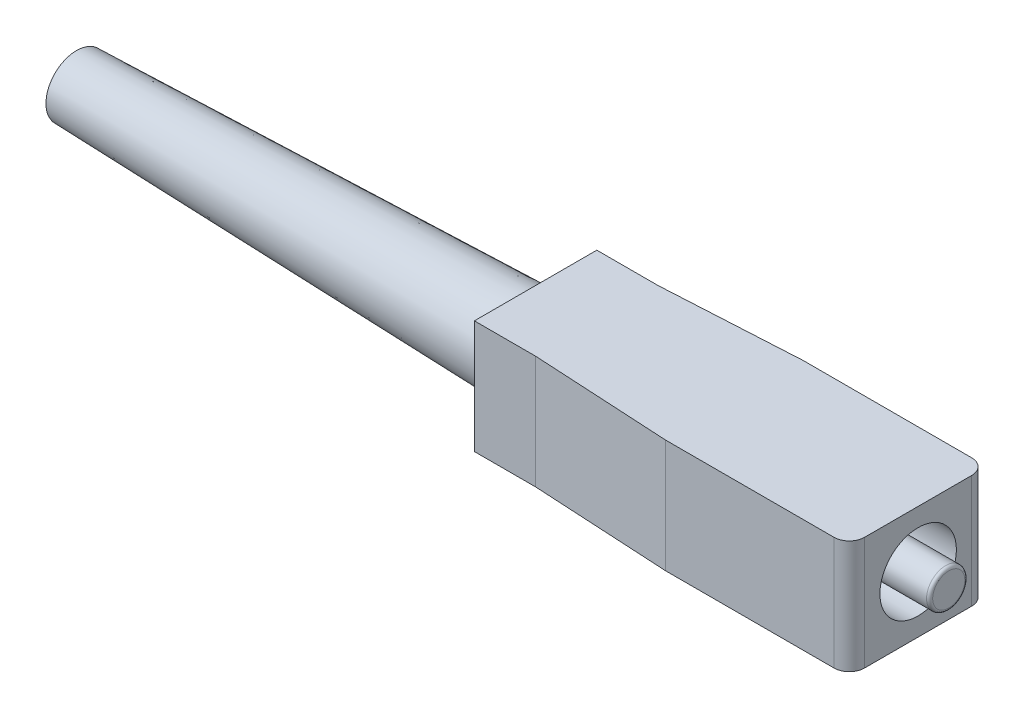
from build123d import *

# Parameters (mm, degrees)
EXTRUDE_1_DEPTH      = 3.7
EXTRUDE_1_DEPTH_BACK = 3.7
SKETCH_3_R           = 2.5
CUT_EXTRUDE_1_DEPTH  = 5
SKETCH_4_R           = 1.25
EXTRUDE_2_DEPTH      = 7
FILLET_1_R           = 1
FILLET_2_R           = 0.2


with BuildPart() as part:
    # 草图2 → 凸台-拉伸1 (new, two sides: drawn at the far end of the back side and taken through both)
    with BuildSketch(Plane(origin=(0, 0, 0), x_dir=(1, 0, 0), z_dir=(0, 1, 0)).offset(-EXTRUDE_1_DEPTH_BACK)):
        Polygon((12, 4.5), (12, -4.5), (0, -4.5), (-9, -4), (-13, -4), (-13, 4), (-9, 4), (0, 4.5), align=None)
    extrude(amount=EXTRUDE_1_DEPTH + EXTRUDE_1_DEPTH_BACK)

    # 草图3 → 切除-拉伸1 (cut)
    with BuildSketch(Plane(origin=(12, 0, 0), x_dir=(0, 0, -1), z_dir=(1, 0, 0))):
        Circle(SKETCH_3_R)
    extrude(amount=-CUT_EXTRUDE_1_DEPTH, mode=Mode.SUBTRACT)

    # 草图4 → 凸台-拉伸2 (add)
    with BuildSketch(Plane(origin=(7, 0, 0), x_dir=(0, 0, -1), z_dir=(1, 0, 0))):
        with Locations(Location((0, 0, 0), (0, 0, 180))):
            Circle(SKETCH_4_R)
    extrude(amount=EXTRUDE_2_DEPTH)

    # 圆角1
    fillet_1_edges = [part.edges().sort_by_distance(p)[0] for p in [
        (12, 0, -4.5),
        (12, 0, 4.5),
    ]]
    fillet(fillet_1_edges, radius=FILLET_1_R)

    # 圆角2
    fillet_2_edges = [part.edges().sort_by_distance(p)[0] for p in [
        (14, 0, -1.25),
    ]]
    fillet(fillet_2_edges, radius=FILLET_2_R)

    # 草图5 → 旋转1 (revolve)
    with BuildSketch(Plane(origin=(0, 0, 0), x_dir=(1, 0, 0), z_dir=(0, 1, 0))):
        Polygon((-13, 2.9), (-43, 2), (-43, 0), (-13, 0), align=None)
    revolve(axis=Axis((5.484305881, 0, 0), (-1, 0, 0)))


solid = part.part
